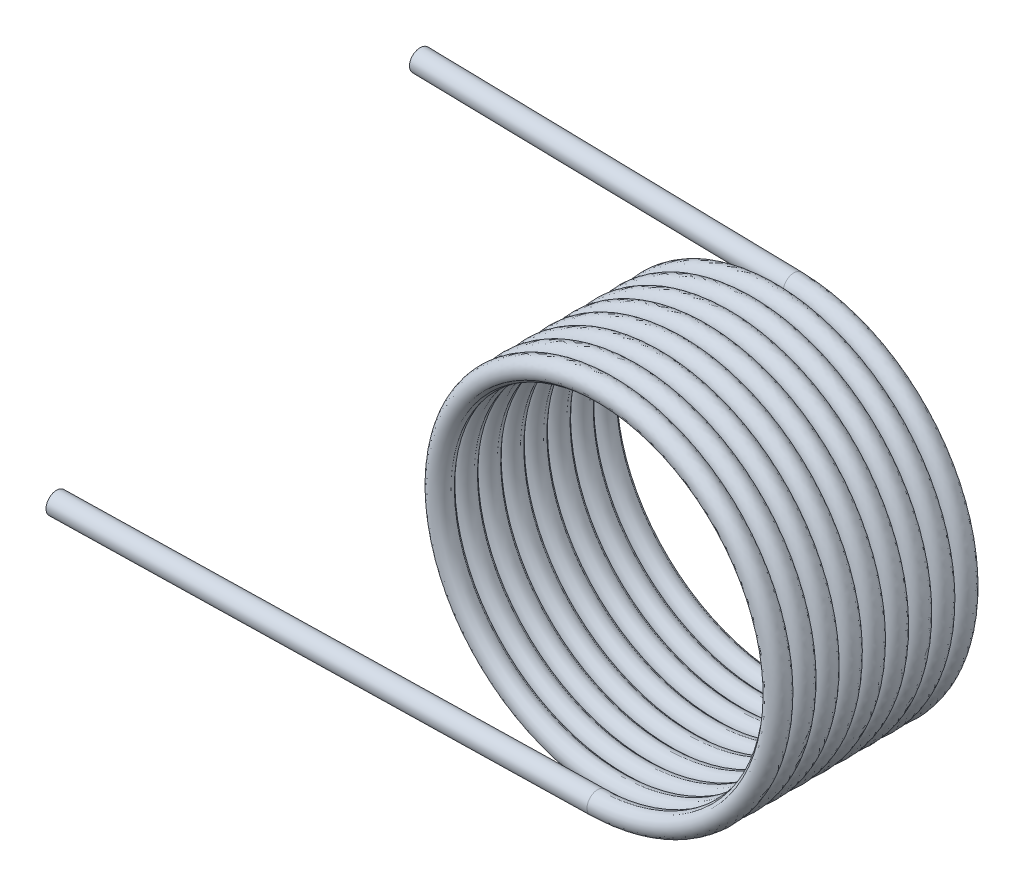
from build123d import *

# Parameters (mm, degrees)
SWEEP1_PITCH        = 3.126153846
SWEEP1_HEIGHT       = 26.572307688
SWEEP1_RADIUS       = 23.60295
SWEEP1_START_ANGLE  = 90
SKETCH2_R           = 1.4351
SKETCH3_R           = 1.4351
BOSS_EXTRUDE1_DEPTH = 101.6
SKETCH4_R           = 1.4351
BOSS_EXTRUDE2_DEPTH = 101.6
SKETCH5_R           = 5.71457576
CUT_EXTRUDE1_DEPTH  = 50
SKETCH6_R           = 6.6278677
CUT_EXTRUDE2_DEPTH  = 30


with BuildPart() as part:
    # Sweep1: sweep along a helix
    with BuildLine() as sweep1_path:
        add(Helix(SWEEP1_PITCH, SWEEP1_HEIGHT, SWEEP1_RADIUS, center=(0, 0, 0), direction=(0, 0, 1), lefthand=True, mode=Mode.PRIVATE).rotate(Axis((0, 0, 0), (0, 0, 1)), SWEEP1_START_ANGLE))
    # Sketch2 → Sweep1 (sweep)
    with BuildSketch(Plane(origin=(0, -23.60295, 26.572307688), x_dir=(0.02107500680690213, -2.8515923258819254e-15, 0.9997778973792575), z_dir=(-0.9997778973792575, 8.282579636549554e-14, 0.02107500680690213))):
        Circle(SKETCH2_R)
    sweep(path=sweep1_path.line, is_frenet=True)

    # Sketch3 → Boss-Extrude1 (add)
    with BuildSketch(Plane(origin=(0, 0, 0), x_dir=(-0.021075006806902132, 0, 0.9997778973792575), z_dir=(-0.9997778973792575, -4.380828031761047e-15, -0.021075006806902132))):
        with Locations((0, 23.60295)):
            Circle(SKETCH3_R)
    extrude(amount=BOSS_EXTRUDE1_DEPTH)

    # Sketch4 → Boss-Extrude2 (add)
    with BuildSketch(Plane(origin=(-0.559887185, 0, 0.011802248), x_dir=(0.021075006806902146, 7.590996781535367e-15, 0.9997778973792575), z_dir=(-0.9997778973792575, -4.4880577867389604e-15, 0.021075006806902146))):
        with Locations((26.566405909, -23.60295)):
            Circle(SKETCH4_R)
    extrude(amount=BOSS_EXTRUDE2_DEPTH)

    # Sketch5 → Cut-Extrude1 (cut)
    with BuildSketch(Plane(origin=(-101.577434374, 0, -2.141220692), x_dir=(-0.021075006806902132, 0, 0.9997778973792575), z_dir=(-0.9997778973792575, -4.3808280317610446e-15, -0.021075006806902132))):
        with Locations((0, 23.60295)):
            Circle(SKETCH5_R)
    extrude(amount=-CUT_EXTRUDE1_DEPTH, mode=Mode.SUBTRACT)

    # Sketch6 → Cut-Extrude2 (cut)
    with BuildSketch(Plane(origin=(-102.137321559, 0, 2.153022939), x_dir=(0.02107500680690215, 0, 0.9997778973792576), z_dir=(-0.9997778973792576, -4.488057786738958e-15, 0.02107500680690215))):
        with Locations((26.566405909, -23.60295)):
            Circle(SKETCH6_R)
    extrude(amount=-CUT_EXTRUDE2_DEPTH, mode=Mode.SUBTRACT)


solid = part.part
